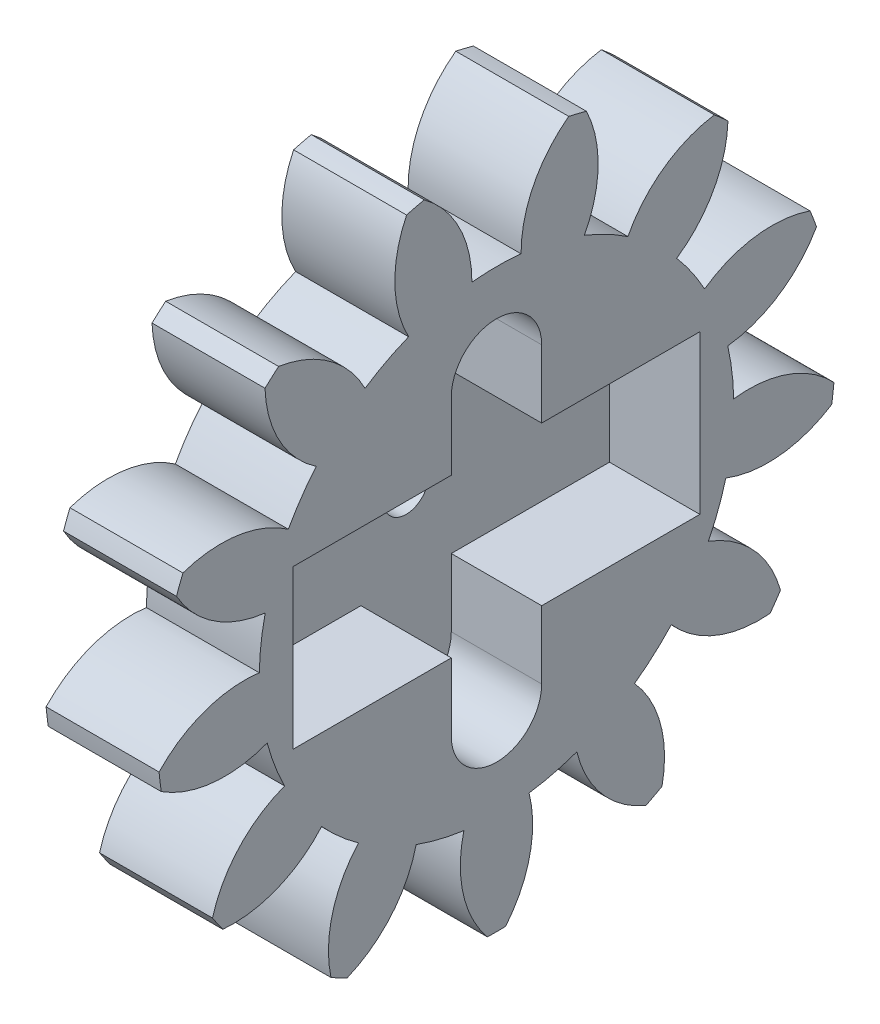
from build123d import *

# Parameters (mm, degrees)
BASPROSKE_W        = 5
BASPROSKE_H        = 15
TOOTHCUT_DEPTH     = 22.794494718
TEETHCUTS_COUNT    = 13
TEETHCUTS_ANGLE    = 332.307692308
BORSKE_R           = 1
BORE_DEPTH         = 50.0000508
CUT_EXTRUDE1_DEPTH = 4


with BuildPart() as part:
    # BasProSke → Base-Revolve (revolve)
    with BuildSketch(Plane(origin=(0, 0, 0), x_dir=(1, 0, 0), z_dir=(0, 1, 0)), mode=Mode.PRIVATE) as base_revolve_sk:
        with Locations((2.5, 7.5)):
            Rectangle(BASPROSKE_W, BASPROSKE_H)
    revolve(base_revolve_sk.sketch.rotate(Axis((-10, 0, 0), (1, 0, 0)), 180), axis=Axis((-10, 0, 0), (1, 0, 0)))

    # TooCutSke → ToothCut (cut, through all)
    with BuildSketch(Plane(origin=(0, 0, 0), x_dir=(0, 0, -1), z_dir=(1, 0, 0))):
        with BuildLine():
            ThreePointArc((1.088245291, 10.442448141), (0, 10.499), (-1.088245291, 10.442448141))
            ThreePointArc((-1.088245291, 10.442448141), (-1.646045958, 12.816546547), (-3.224884568, 14.675243258))
            ThreePointArc((-3.224884568, 14.675243258), (0, 15.0254), (3.224884568, 14.675243258))
            ThreePointArc((3.224884568, 14.675243258), (1.646045958, 12.816546547), (1.088245291, 10.442448141))
        make_face()
    toothcut = extrude(amount=TOOTHCUT_DEPTH, mode=Mode.SUBTRACT)

    # TeethCuts: ToothCut ×13 about axis
    teethcuts_axis = Axis((-10, 0, 0), (1, 0, 0))
    for i in range(1, TEETHCUTS_COUNT):
        add(toothcut.rotate(teethcuts_axis, i * TEETHCUTS_ANGLE / (TEETHCUTS_COUNT - 1)), mode=Mode.SUBTRACT)

    # BorSke → Bore (cut, symmetric)
    with BuildSketch(Plane(origin=(0, 0, 0), x_dir=(0, 0, -1), z_dir=(1, 0, 0))):
        with Locations(Location((0, 0, 0), (0, 0, 180))):
            Circle(BORSKE_R)
    extrude(amount=BORE_DEPTH, both=True, mode=Mode.SUBTRACT)

    # Sketch1 → Cut-Extrude1 (cut)
    with BuildSketch(Plane(origin=(5, 0, 0), x_dir=(0, 0, -1), z_dir=(1, 0, 0))):
        with BuildLine():
            Line((2, 6.5), (2, 3.5))
            Line((2, 3.5), (9, 3.5))
            Line((9, 3.5), (9, -3.5))
            Line((9, -3.5), (2, -3.5))
            Line((2, -3.5), (2, -6.5))
            ThreePointArc((2, -6.5), (0, -8.5), (-2, -6.5))
            Line((-2, -6.5), (-2, -3.5))
            Line((-2, -3.5), (-9, -3.5))
            Line((-9, -3.5), (-9, 3.5))
            Line((-9, 3.5), (-2, 3.5))
            Line((-2, 3.5), (-2, 6.5))
            ThreePointArc((-2, 6.5), (0, 8.5), (2, 6.5))
        make_face()
    extrude(amount=-CUT_EXTRUDE1_DEPTH, mode=Mode.SUBTRACT)


solid = part.part
